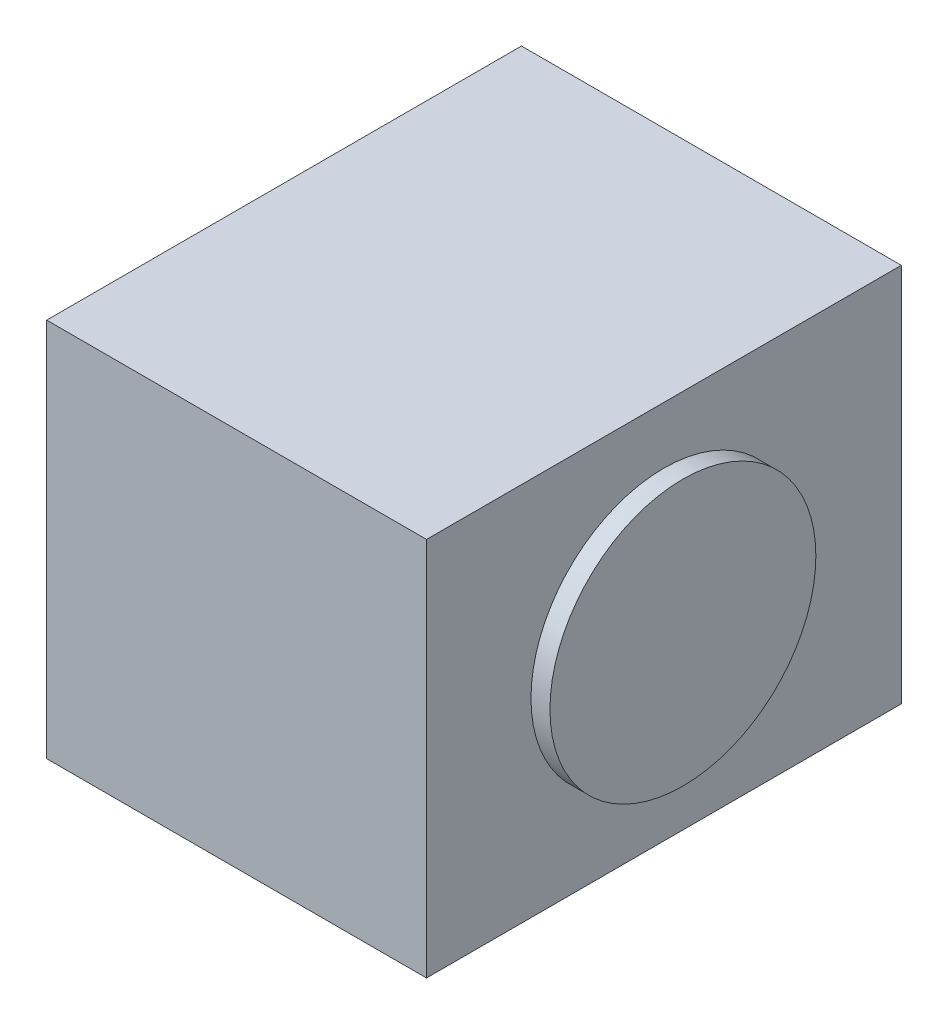
from build123d import *

# Parameters (mm, degrees)
ESQUISSE1_W             = 200
ESQUISSE1_H             = 200
BOSS_EXTRU_1_DEPTH      = 250
ESQUISSE2_R             = 70
ENL_V_MAT_EXTRU_1_DEPTH = 10
ESQUISSE3_R             = 70
BOSS_EXTRU_2_DEPTH      = 10


with BuildPart() as part:
    # Esquisse1 → Boss.-Extru.1 (new body)
    with BuildSketch(Plane.XY):
        with Locations((-100, -100)):
            Rectangle(ESQUISSE1_W, ESQUISSE1_H)
    extrude(amount=BOSS_EXTRU_1_DEPTH)

    # Esquisse2 → Enlèv. mat.-Extru.1 (cut)
    with BuildSketch(Plane(origin=(0, 0, 0), x_dir=(-1, 0, 0), z_dir=(0, 0, -1))):
        with Locations((100, -100)):
            Circle(ESQUISSE2_R)
    extrude(amount=-ENL_V_MAT_EXTRU_1_DEPTH, mode=Mode.SUBTRACT)

    # Esquisse3 → Boss.-Extru.2 (add)
    with BuildSketch(Plane(origin=(0, 0, 0), x_dir=(0, 0, -1), z_dir=(1, 0, 0))):
        with Locations(Location((-125, -100, 0), (0, 0, 90))):
            Circle(ESQUISSE3_R)
    extrude(amount=BOSS_EXTRU_2_DEPTH)


solid = part.part
